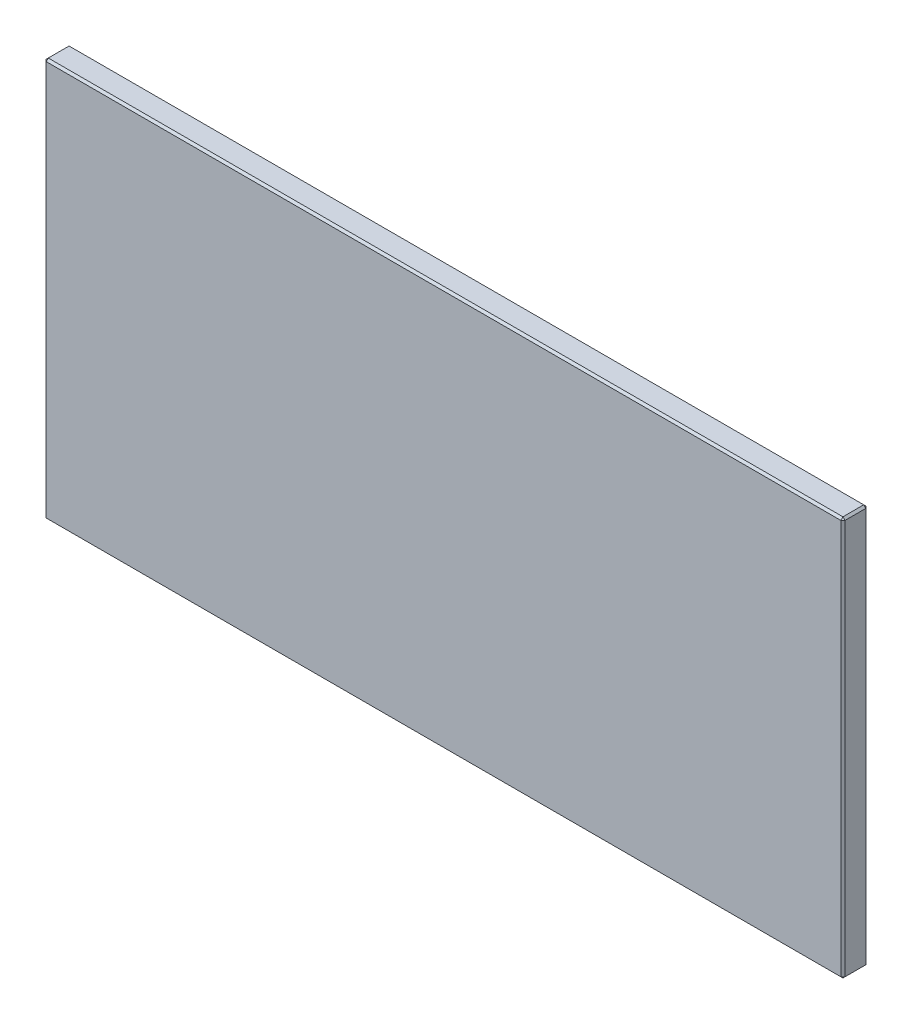
from build123d import *

# Parameters (mm, degrees)
SKETCH1_W          = 1219.2
SKETCH1_H          = 609.6
BASE_EXTRUDE_DEPTH = 38.1
CHAMFER1_SIZE      = 3.175


with BuildPart() as part:
    # Sketch1 → Base-Extrude (new body)
    with BuildSketch(Plane.XY):
        Rectangle(SKETCH1_W, SKETCH1_H)
    extrude(amount=BASE_EXTRUDE_DEPTH)

    # Chamfer1
    chamfer1_edges = [part.edges().sort_by_distance(p)[0] for p in [
        (-609.6, 304.8, 19.05),
        (609.6, 304.8, 19.05),
        (0, 304.8, 0),
        (0, 304.8, 38.1),
        (609.6, -304.8, 19.05),
        (609.6, 0, 0),
        (609.6, 0, 38.1),
        (-609.6, -304.8, 19.05),
        (0, -304.8, 0),
        (0, -304.8, 38.1),
        (-609.6, 0, 0),
        (-609.6, 0, 38.1),
    ]]
    chamfer(chamfer1_edges, length=CHAMFER1_SIZE)


solid = part.part
